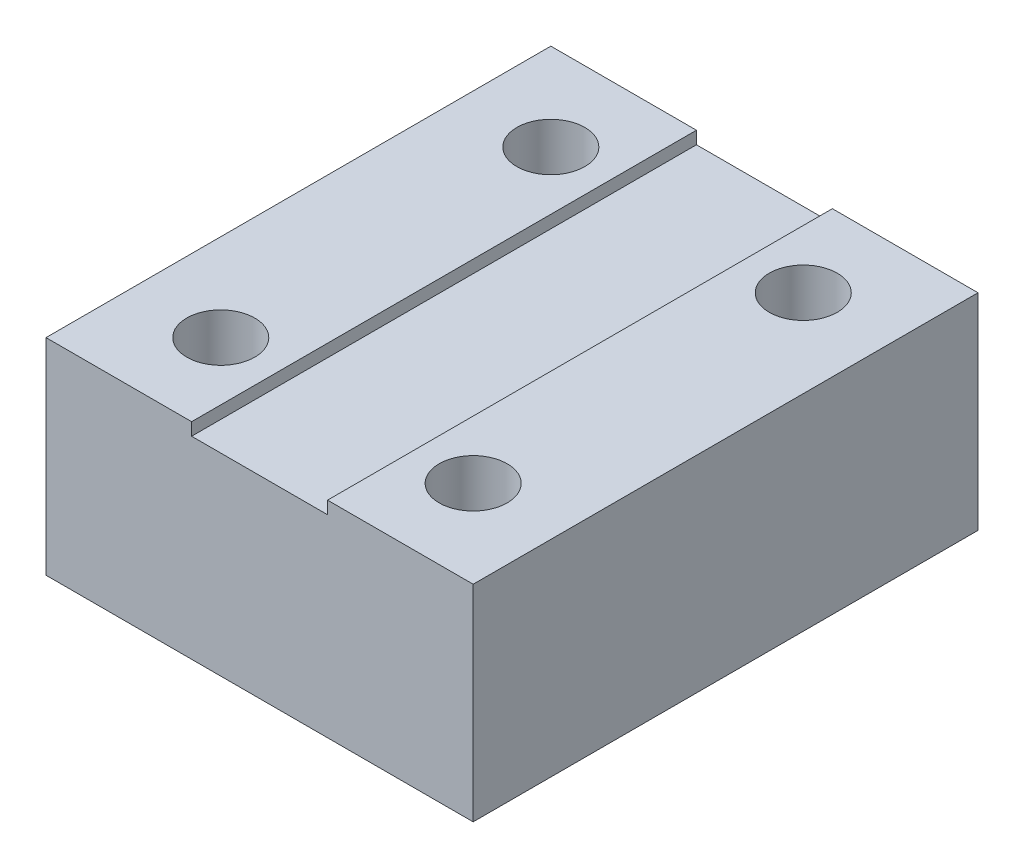
from build123d import *

# Parameters (mm, degrees)
SCHIZZO1_W                   = 22
SCHIZZO1_H                   = 10.6
ESTRUSIONE_ESTRUSIONE1_DEPTH = 13
TAGLIO_ESTRUSIONE3_REACH     = 22.059
SCHIZZO5_R                   = 1.75
SCHIZZO5_3_W                 = 7
SCHIZZO5_3_H                 = 26
TAGLIO_ESTRUSIONE4_DEPTH     = 0.65


with BuildPart() as part:
    # Schizzo1 → Estrusione-Estrusione1 (new, symmetric)
    with BuildSketch(Plane.XY):
        Rectangle(SCHIZZO1_W, SCHIZZO1_H)
    extrude(amount=ESTRUSIONE_ESTRUSIONE1_DEPTH, both=True)

    # Schizzo5 → Taglio-Estrusione3 (cut, up to next)
    with BuildSketch(Plane(origin=(0, 5.3, 0), x_dir=(1, 0, 0), z_dir=(0, 1, 0)), mode=Mode.PRIVATE) as taglio_estrusione3_sk1:
        with Locations((6.5, 8.5)):
            Circle(SCHIZZO5_R)
    taglio_estrusione3_tool1 = extrude(taglio_estrusione3_sk1.sketch, amount=-TAGLIO_ESTRUSIONE3_REACH, mode=Mode.PRIVATE) & part.part
    # Schizzo5 → Taglio-Estrusione3 (cut, up to next)
    with BuildSketch(Plane(origin=(0, 5.3, 0), x_dir=(1, 0, 0), z_dir=(0, 1, 0)), mode=Mode.PRIVATE) as taglio_estrusione3_sk2:
        with Locations((6.5, -8.5)):
            Circle(SCHIZZO5_R)
    taglio_estrusione3_tool2 = extrude(taglio_estrusione3_sk2.sketch, amount=-TAGLIO_ESTRUSIONE3_REACH, mode=Mode.PRIVATE) & part.part
    # Schizzo5 → Taglio-Estrusione3 (cut, up to next)
    with BuildSketch(Plane(origin=(0, 5.3, 0), x_dir=(1, 0, 0), z_dir=(0, 1, 0)), mode=Mode.PRIVATE) as taglio_estrusione3_sk3:
        with Locations((-6.5, -8.5)):
            Circle(SCHIZZO5_R)
    taglio_estrusione3_tool3 = extrude(taglio_estrusione3_sk3.sketch, amount=-TAGLIO_ESTRUSIONE3_REACH, mode=Mode.PRIVATE) & part.part
    # Schizzo5 → Taglio-Estrusione3 (cut, up to next)
    with BuildSketch(Plane(origin=(0, 5.3, 0), x_dir=(1, 0, 0), z_dir=(0, 1, 0)), mode=Mode.PRIVATE) as taglio_estrusione3_sk4:
        with Locations((-6.5, 8.5)):
            Circle(SCHIZZO5_R)
    taglio_estrusione3_tool4 = extrude(taglio_estrusione3_sk4.sketch, amount=-TAGLIO_ESTRUSIONE3_REACH, mode=Mode.PRIVATE) & part.part
    add(taglio_estrusione3_tool1.solids().sort_by_distance((6.5, 5.3, -8.5))[0], mode=Mode.SUBTRACT)
    add(taglio_estrusione3_tool2.solids().sort_by_distance((6.5, 5.3, 8.5))[0], mode=Mode.SUBTRACT)
    add(taglio_estrusione3_tool3.solids().sort_by_distance((-6.5, 5.3, 8.5))[0], mode=Mode.SUBTRACT)
    add(taglio_estrusione3_tool4.solids().sort_by_distance((-6.5, 5.3, -8.5))[0], mode=Mode.SUBTRACT)

    # Schizzo5<3> → Taglio-Estrusione4 (cut)
    with BuildSketch(Plane(origin=(0, 5.3, 0), x_dir=(1, 0, 0), z_dir=(0, 1, 0))):
        Rectangle(SCHIZZO5_3_W, SCHIZZO5_3_H)
    extrude(amount=-TAGLIO_ESTRUSIONE4_DEPTH, mode=Mode.SUBTRACT)


solid = part.part
